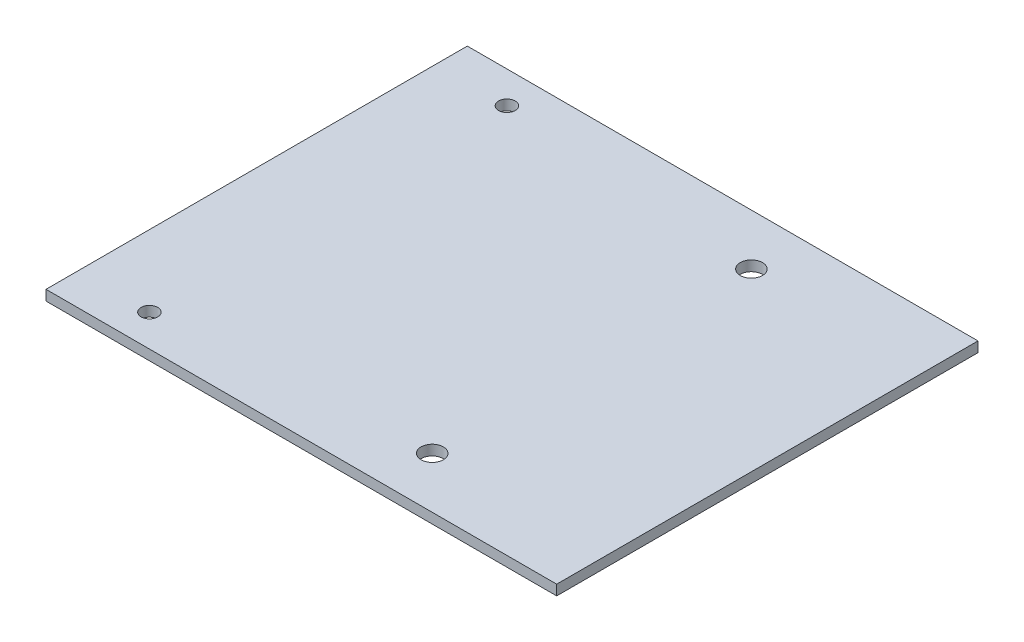
from build123d import *

# Parameters (mm, degrees)
SKETCH1_W           = 80
SKETCH1_H           = 66
BOSS_EXTRUDE1_DEPTH = 1.6
SKETCH2_R           = 1.3
CUT_EXTRUDE1_DEPTH  = 1.6
CUT_EXTRUDE2_REACH  = 53.88
SKETCH4_R           = 1.75


with BuildPart() as part:
    # Sketch1 → Boss-Extrude1 (new body)
    with BuildSketch(Plane(origin=(0, 0, 0), x_dir=(1, 0, 0), z_dir=(0, 1, 0))):
        Rectangle(SKETCH1_W, SKETCH1_H)
    extrude(amount=BOSS_EXTRUDE1_DEPTH)

    # Sketch2 → Cut-Extrude1 (cut)
    with BuildSketch(Plane(origin=(0, 1.6, 0), x_dir=(1, 0, 0), z_dir=(0, 1, 0))):
        with Locations(Location((-28.802, 28, 0), (0, 0, 270))):
            Circle(SKETCH2_R)
        with Locations(Location((-28.802, -28, 0), (0, 0, 270))):
            Circle(SKETCH2_R)
    extrude(amount=-CUT_EXTRUDE1_DEPTH, mode=Mode.SUBTRACT)

    # Sketch4 → Cut-Extrude2 (cut, up to next)
    with BuildSketch(Plane(origin=(0, 1.6, 0), x_dir=(1, 0, 0), z_dir=(0, 1, 0)), mode=Mode.PRIVATE) as cut_extrude2_sk1:
        with Locations(Location((12.5, 25, 0), (0, 0, 270))):
            Circle(SKETCH4_R)
    cut_extrude2_tool1 = extrude(cut_extrude2_sk1.sketch, amount=-CUT_EXTRUDE2_REACH, mode=Mode.PRIVATE) & part.part
    # Sketch4 → Cut-Extrude2 (cut, up to next)
    with BuildSketch(Plane(origin=(0, 1.6, 0), x_dir=(1, 0, 0), z_dir=(0, 1, 0)), mode=Mode.PRIVATE) as cut_extrude2_sk2:
        with Locations(Location((12.5, -25, 0), (0, 0, 270))):
            Circle(SKETCH4_R)
    cut_extrude2_tool2 = extrude(cut_extrude2_sk2.sketch, amount=-CUT_EXTRUDE2_REACH, mode=Mode.PRIVATE) & part.part
    add(cut_extrude2_tool1.solids().sort_by_distance((12.5, 1.6, -25))[0], mode=Mode.SUBTRACT)
    add(cut_extrude2_tool2.solids().sort_by_distance((12.5, 1.6, 25))[0], mode=Mode.SUBTRACT)


solid = part.part
